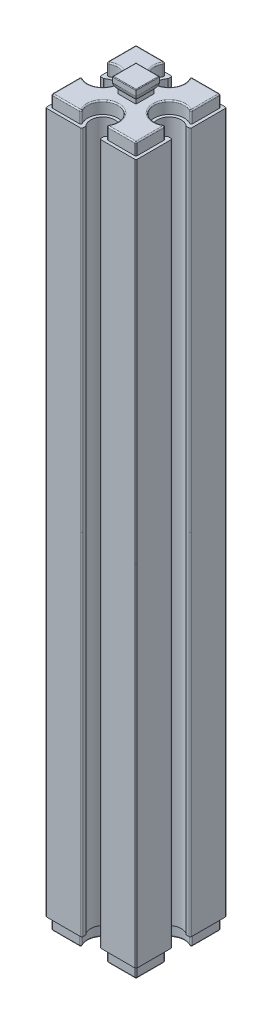
from build123d import *

# Parameters (mm, degrees)
EXTRUDE_1_DEPTH        = 58
EXTRUDE_2_DEPTH        = 2
EXTRUDE_3_DEPTH        = 2
FILLET_3_R             = 0.2
CUT_EXTRUDE_1_DEPTH    = 3
FILLET_4_R             = 0.2
FILLET_5_R             = 0.1
FILLET_3_OF_MIRROR_1_R = 0.2
FILLET_4_OF_MIRROR_1_R = 0.2
FILLET_5_OF_MIRROR_1_R = 0.1


with BuildPart() as part:
    # 草图1 → 凸台-拉伸1 (new body)
    with BuildSketch(Plane(origin=(0, 0, 0), x_dir=(1, 0, 0), z_dir=(0, 1, 0))):
        with BuildLine():
            Line((-7.5, 7.5), (-1.5, 7.5))
            Line((-1.5, 7.5), (-1.5, 6.822875656))
            ThreePointArc((-1.5, 6.822875656), (0, 3.5), (1.5, 6.822875656))
            Line((1.5, 6.822875656), (1.5, 7.5))
            Line((1.5, 7.5), (7.5, 7.5))
            Line((7.5, 7.5), (7.5, 1.5))
            Line((7.5, 1.5), (6.822875656, 1.5))
            ThreePointArc((6.822875656, 1.5), (3.5, 0), (6.822875656, -1.5))
            Line((6.822875656, -1.5), (7.5, -1.5))
            Line((7.5, -1.5), (7.5, -7.5))
            Line((7.5, -7.5), (1.5, -7.5))
            Line((1.5, -7.5), (1.5, -6.822875656))
            ThreePointArc((1.5, -6.822875656), (0, -3.5), (-1.5, -6.822875656))
            Line((-1.5, -6.822875656), (-1.5, -7.5))
            Line((-1.5, -7.5), (-7.5, -7.5))
            Line((-7.5, -7.5), (-7.5, -1.5))
            Line((-7.5, -1.5), (-6.822875656, -1.5))
            ThreePointArc((-6.822875656, -1.5), (-3.5, 0), (-6.822875656, 1.5))
            Line((-6.822875656, 1.5), (-7.5, 1.5))
            Line((-7.5, 1.5), (-7.5, 7.5))
        make_face()
    extrude_1 = extrude(amount=EXTRUDE_1_DEPTH)

    # 草图2 → 凸台-拉伸2 (add)
    with BuildSketch(Plane(origin=(0, 58, 0), x_dir=(1, 0, 0), z_dir=(0, 1, 0))):
        with BuildLine():
            Line((-7, 7), (-7, 2))
            ThreePointArc((-7, 2), (-3, 0), (-7, -2))
            Line((-7, -2), (-7, -7))
            Line((-7, -7), (-2, -7))
            ThreePointArc((-2, -7), (0, -3), (2, -7))
            Line((2, -7), (7, -7))
            Line((7, -7), (7, -2))
            ThreePointArc((7, -2), (3, 0), (7, 2))
            Line((7, 2), (7, 7))
            Line((7, 7), (2, 7))
            ThreePointArc((2, 7), (0, 3), (-2, 7))
            Line((-2, 7), (-7, 7))
        make_face()
    extrude_2 = extrude(amount=EXTRUDE_2_DEPTH)

    # 草图3 → 凸台-拉伸3 (add, symmetric)
    with BuildSketch(Plane(origin=(0, 0, 0), x_dir=(0, 0, -1), z_dir=(1, 0, 0))):
        with BuildLine():
            Line((-1.5, 60), (1.5, 60))
            Line((1.5, 60), (1.5, 60.677124344))
            ThreePointArc((1.5, 60.677124344), (1.780042303, 61.088161527), (1.95, 61.555590279))
            Line((1.95, 61.555590279), (1.95, 62.5))
            Line((1.95, 62.5), (-1.95, 62.5))
            Line((-1.95, 62.5), (-1.95, 61.555590279))
            ThreePointArc((-1.95, 61.555590279), (-1.780042303, 61.088161527), (-1.5, 60.677124344))
            Line((-1.5, 60.677124344), (-1.5, 60))
        make_face()
    extrude_3 = extrude(amount=EXTRUDE_3_DEPTH, both=True)

    # 圆角3
    fillet_3_edges = [part.edges().sort_by_distance(p)[0] for p in [
        (-7.5, 29, -7.5),
        (-1.5, 29, -7.5),
        (1.5, 29, -7.5),
        (7.5, 29, -7.5),
        (7.5, 29, -1.5),
        (7.5, 29, 1.5),
        (7.5, 29, 7.5),
        (1.5, 29, 7.5),
        (-1.5, 29, 7.5),
        (-7.5, 29, 7.5),
        (-7.5, 29, 1.5),
        (-6.822875656, 29, -1.5),
        (-7.5, 29, -1.5),
    ]]
    fillet(fillet_3_edges, radius=FILLET_3_R)

    # 草图4 → 切除-拉伸1 (cut, symmetric)
    with BuildSketch(Plane.XY):
        with BuildLine():
            Line((1.95, 62.5), (2, 62.5))
            Line((2, 62.5), (2, 60))
            Line((2, 60), (1.5, 60))
            Line((1.5, 60), (1.5, 60.677124344))
            ThreePointArc((1.5, 60.677124344), (1.780042303, 61.088161527), (1.95, 61.555590279))
            Line((1.95, 61.555590279), (1.95, 62.5))
        make_face()
        with BuildLine():
            Line((-1.95, 62.5), (-1.95, 61.555590279))
            ThreePointArc((-1.95, 61.555590279), (-1.780042303, 61.088161527), (-1.5, 60.677124344))
            Line((-1.5, 60.677124344), (-1.5, 60))
            Line((-1.5, 60), (-2, 60))
            Line((-2, 60), (-2, 62.5))
            Line((-2, 62.5), (-1.95, 62.5))
        make_face()
    cut_extrude_1 = extrude(amount=CUT_EXTRUDE_1_DEPTH, both=True, mode=Mode.SUBTRACT)

    # 圆角4
    fillet_4_edges = [part.edges().sort_by_distance(p)[0] for p in [
        (-2, 59, -7),
        (-7, 59, -7),
        (-7, 59, -2),
        (-7, 59, 2),
        (-7, 59, 7),
        (-2, 59, 7),
        (2, 59, 7),
        (7, 59, 7),
        (7, 59, 2),
        (7, 59, -2),
        (7, 59, -7),
        (2, 59, -7),
        (-4.5, 60, -7),
        (-7, 60, -4.5),
        (-3, 60, 0),
        (-7, 60, 4.5),
        (-4.5, 60, 7),
        (0, 60, 3),
        (4.5, 60, 7),
        (7, 60, 4.5),
        (3, 60, 0),
        (7, 60, -4.5),
        (4.5, 60, -7),
        (0, 60, -3),
    ]]
    fillet(fillet_4_edges, radius=FILLET_4_R)

    # 圆角5
    fillet_5_edges = [part.edges().sort_by_distance(p)[0] for p in [
        (1.95, 62.5, 0),
        (0, 62.5, -1.95),
        (0, 62.5, 1.95),
        (-1.95, 62.5, 0),
    ]]
    fillet(fillet_5_edges, radius=FILLET_5_R)


with BuildPart() as mirror_1_1:
    # 镜向1: 凸台-拉伸1, 凸台-拉伸2, 凸台-拉伸3 across Top Plane
    add(extrude_1.mirror(Plane(origin=(0, 0, 0), x_dir=(1, 0, 0), z_dir=(0, 1, 0))))
    add(extrude_2.mirror(Plane(origin=(0, 0, 0), x_dir=(1, 0, 0), z_dir=(0, 1, 0))))
    add(extrude_3.mirror(Plane(origin=(0, 0, 0), x_dir=(1, 0, 0), z_dir=(0, 1, 0))))

    # Mirror 1 2: 切除-拉伸1 across Top Plane
    add(cut_extrude_1.mirror(Plane(origin=(0, 0, 0), x_dir=(1, 0, 0), z_dir=(0, 1, 0))), mode=Mode.SUBTRACT)

    # 圆角3 of 镜向1
    fillet_3_of_mirror_1_edges = [mirror_1_1.edges().sort_by_distance(p)[0] for p in [
        (-7.5, -29, -7.5),
        (-1.5, -29, -7.5),
        (1.5, -29, -7.5),
        (7.5, -29, -7.5),
        (7.5, -29, -1.5),
        (7.5, -29, 1.5),
        (7.5, -29, 7.5),
        (1.5, -29, 7.5),
        (-1.5, -29, 7.5),
        (-7.5, -29, 7.5),
        (-7.5, -29, 1.5),
        (-6.822875656, -29, -1.5),
        (-7.5, -29, -1.5),
    ]]
    fillet(fillet_3_of_mirror_1_edges, radius=FILLET_3_OF_MIRROR_1_R)

    # 圆角4 of 镜向1
    fillet_4_of_mirror_1_edges = [mirror_1_1.edges().sort_by_distance(p)[0] for p in [
        (-2, -59, -7),
        (-7, -59, -7),
        (-7, -59, -2),
        (-7, -59, 2),
        (-7, -59, 7),
        (-2, -59, 7),
        (2, -59, 7),
        (7, -59, 7),
        (7, -59, 2),
        (7, -59, -2),
        (7, -59, -7),
        (2, -59, -7),
        (-4.5, -60, -7),
        (-7, -60, -4.5),
        (-3, -60, 0),
        (-7, -60, 4.5),
        (-4.5, -60, 7),
        (0, -60, 3),
        (4.5, -60, 7),
        (7, -60, 4.5),
        (3, -60, 0),
        (7, -60, -4.5),
        (4.5, -60, -7),
        (0, -60, -3),
    ]]
    fillet(fillet_4_of_mirror_1_edges, radius=FILLET_4_OF_MIRROR_1_R)

    # 圆角5 of 镜向1
    fillet_5_of_mirror_1_edges = [mirror_1_1.edges().sort_by_distance(p)[0] for p in [
        (1.95, -62.5, 0),
        (0, -62.5, -1.95),
        (0, -62.5, 1.95),
        (-1.95, -62.5, 0),
    ]]
    fillet(fillet_5_of_mirror_1_edges, radius=FILLET_5_OF_MIRROR_1_R)


with BuildPart() as part_1:
    add(part.part)

    # 镜向1 united with what the copies tou: union 镜向1_1
    add(mirror_1_1.part)


solid = part_1.part
